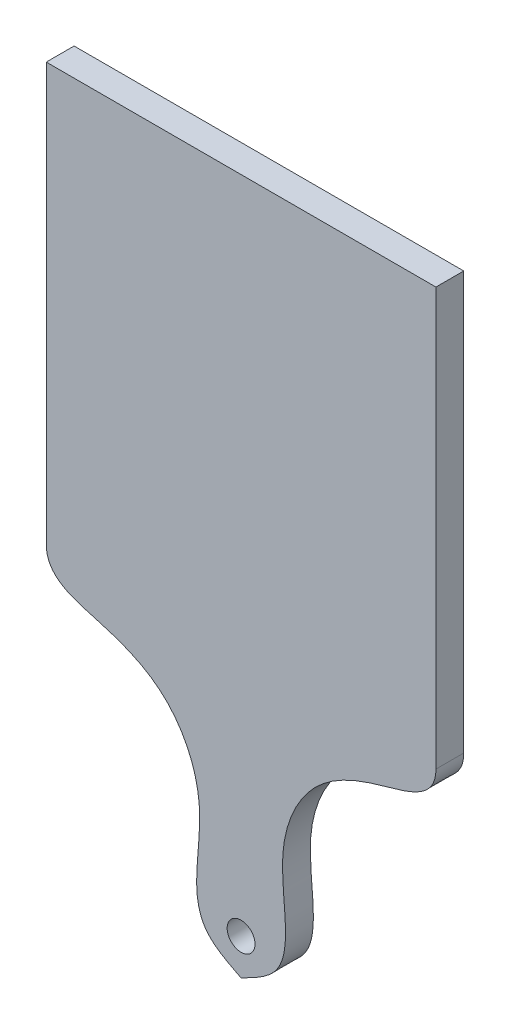
from build123d import *

# Parameters (mm, degrees)
BOSS_EXTRUDE1_DEPTH = 10
SKETCH2_R           = 5
CUT_EXTRUDE1_DEPTH  = 10


with BuildPart() as part:
    # Sketch1 → Boss-Extrude1 (new body)
    with BuildSketch(Plane.XY):
        with BuildLine():
            Line((70, 87), (70, 237))
            Line((70, 237), (-70, 237))
            Line((-70, 237), (-70, 87))
            add(Edge.make_bspline(
                [(0, -13), (-4.605948028, -10.653982198), (-21.385528158, -2.10738257), (-9.908182864, 31.191471557), (-24.240732749, 61.889747712), (-47.857626179, 72.570821606), (-70, 76.647728673), (-70, 87)],
                knots=[0, 0, 0, 0, 0.050956587, 0.18563608, 0.29003014, 0.381689368, 0.470019459, 0.470019459, 0.470019459, 0.470019459], degree=3))
            add(Edge.make_bspline(
                [(0, -13), (4.605948028, -10.653982198), (21.385528158, -2.10738257), (9.908182864, 31.191471557), (24.240732749, 61.889747712), (47.857626179, 72.570821606), (70, 76.647728673), (70, 87)],
                knots=[0, 0, 0, 0, 0.050956587, 0.18563608, 0.29003014, 0.381689368, 0.470019459, 0.470019459, 0.470019459, 0.470019459], degree=3))
        make_face()
    extrude(amount=BOSS_EXTRUDE1_DEPTH)

    # Sketch2 → Cut-Extrude1 (cut)
    with BuildSketch(Plane(origin=(0, 0, 0), x_dir=(-1, 0, 0), z_dir=(0, 0, -1))):
        Circle(SKETCH2_R)
    extrude(amount=-CUT_EXTRUDE1_DEPTH, mode=Mode.SUBTRACT)


solid = part.part
